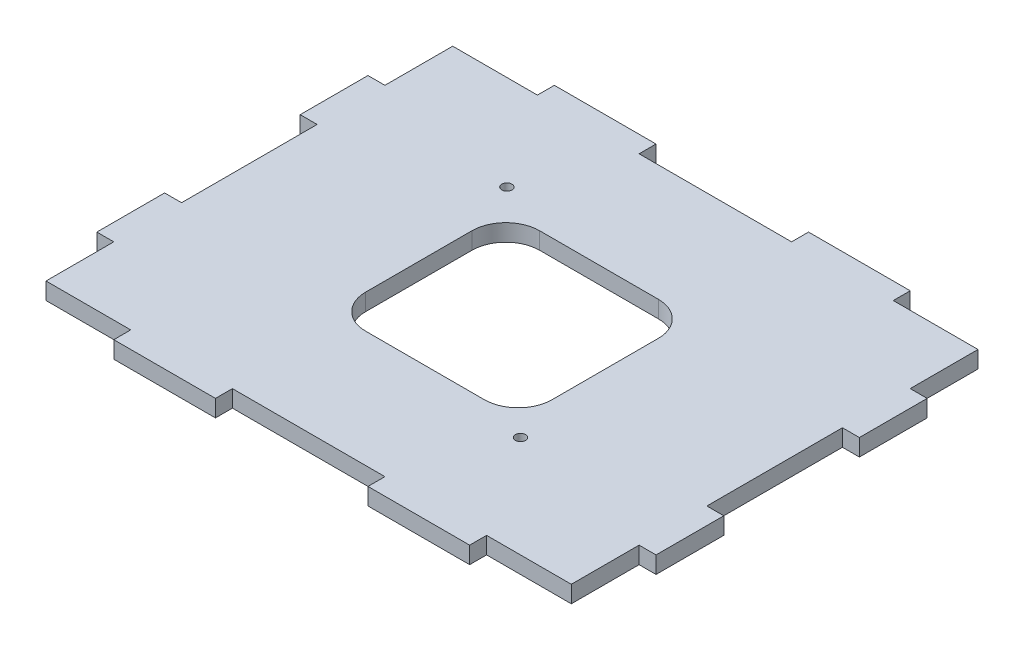
from build123d import *

# Parameters (mm, degrees)
BOSS_EXTRUDE1_DEPTH = 5
SKETCH3_R           = 1.5
CUT_EXTRUDE3_DEPTH  = 10


with BuildPart() as part:
    # Sketch1 → Boss-Extrude1 (new body)
    with BuildSketch(Plane(origin=(0, 0, 0), x_dir=(1, 0, 0), z_dir=(0, 1, 0))):
        Polygon((-77.5, 60), (-52.5, 60), (-52.5, 65), (-22.5, 65), (-22.5, 60), (22.5, 60), (22.5, 65), (52.5, 65), (52.5, 60), (77.5, 60), (77.5, 40), (82.5, 40), (82.5, 20), (77.5, 20), (77.5, -20), (82.5, -20), (82.5, -40), (77.5, -40), (77.5, -60), (52.5, -60), (52.5, -65), (22.5, -65), (22.5, -60), (-22.5, -60), (-22.5, -65), (-52.5, -65), (-52.5, -60), (-77.5, -60), (-77.5, -40), (-82.5, -40), (-82.5, -20), (-77.5, -20), (-77.5, 20), (-82.5, 20), (-82.5, 40), (-77.5, 40), align=None)
    extrude(amount=BOSS_EXTRUDE1_DEPTH)

    # Sketch3 → Cut-Extrude3 (cut)
    with BuildSketch(Plane(origin=(0, 5, 0), x_dir=(1, 0, 0), z_dir=(0, 1, 0))):
        with Locations(Location((-33.5, 32, 0), (0, 0, 270))):
            Circle(SKETCH3_R)
        with Locations(Location((32.5, -30, 0), (0, 0, 270))):
            Circle(SKETCH3_R)
        with BuildLine():
            Line((17.5, -25.666666667), (-17.5, -25.666666667))
            ThreePointArc((-17.5, -25.666666667), (-24.571067812, -22.737734479), (-27.5, -15.666666667))
            Line((-27.5, -15.666666667), (-27.5, 15.666666667))
            ThreePointArc((-27.5, 15.666666667), (-24.571067812, 22.737734479), (-17.5, 25.666666667))
            Line((-17.5, 25.666666667), (17.5, 25.666666667))
            ThreePointArc((17.5, 25.666666667), (24.571067812, 22.737734479), (27.5, 15.666666667))
            Line((27.5, 15.666666667), (27.5, -15.666666667))
            ThreePointArc((27.5, -15.666666667), (24.571067812, -22.737734479), (17.5, -25.666666667))
        make_face()
    extrude(amount=-CUT_EXTRUDE3_DEPTH, mode=Mode.SUBTRACT)


solid = part.part
